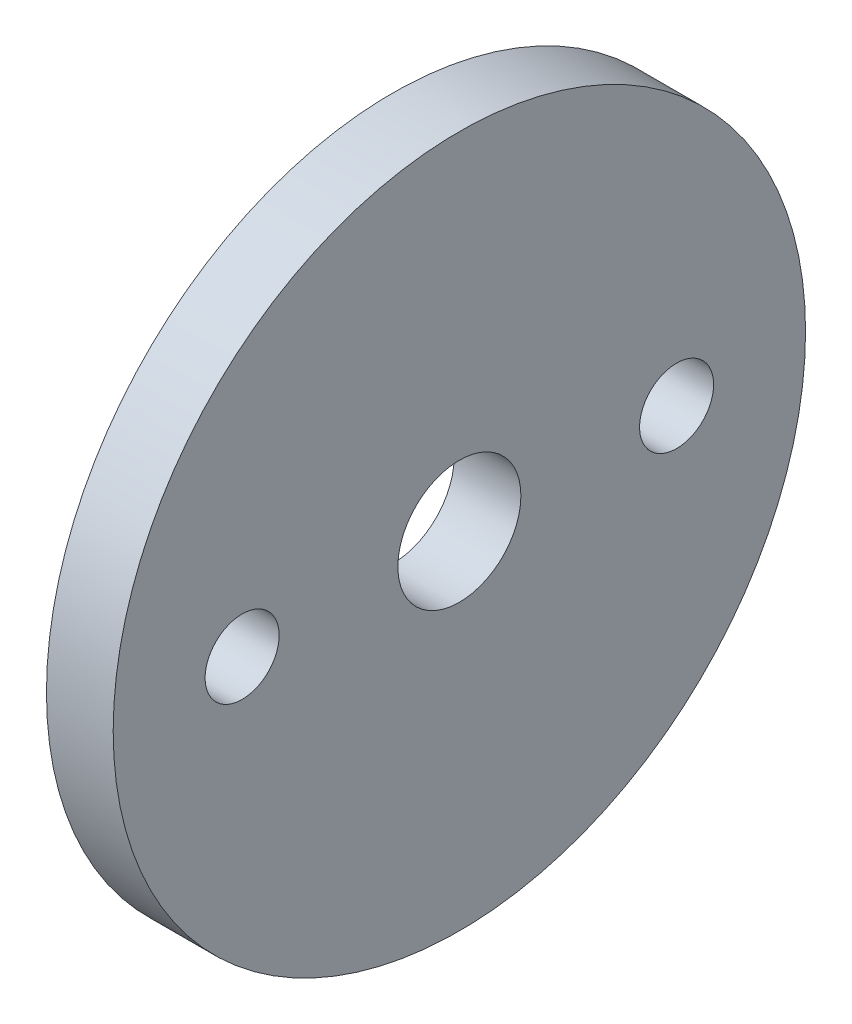
from build123d import *

# Parameters (mm, degrees)
SKETCH1_R                     = 12.6492
BOSS_EXTRUDE1_DEPTH           = 2.4384
F_8_THREADED_ROD_CLEARANCE_D  = 4.4958
EJECTION_CHARGE_PASSTHROUGH_D = 2.7051


with BuildPart() as part:
    # Sketch1 → Boss-Extrude1 (new body)
    with BuildSketch(Plane(origin=(0, 0, 0), x_dir=(0, 0, -1), z_dir=(1, 0, 0))):
        Circle(SKETCH1_R)
    extrude(amount=BOSS_EXTRUDE1_DEPTH)

    # #8 Threaded Rod Clearance (through all)
    with Locations(Plane(origin=(2.4384, 0, 0), x_dir=(0, 0, -1), z_dir=(1, 0, 0))):
        with Locations((0, 0)):
            Hole(F_8_THREADED_ROD_CLEARANCE_D / 2)

    # Ejection Charge Passthrough (through all)
    with Locations(Plane(origin=(2.4384, 0, 0), x_dir=(0, 0, -1), z_dir=(1, 0, 0))):
        with Locations((-7.9375, 0), (7.9375, 0)):
            Hole(EJECTION_CHARGE_PASSTHROUGH_D / 2)


solid = part.part
